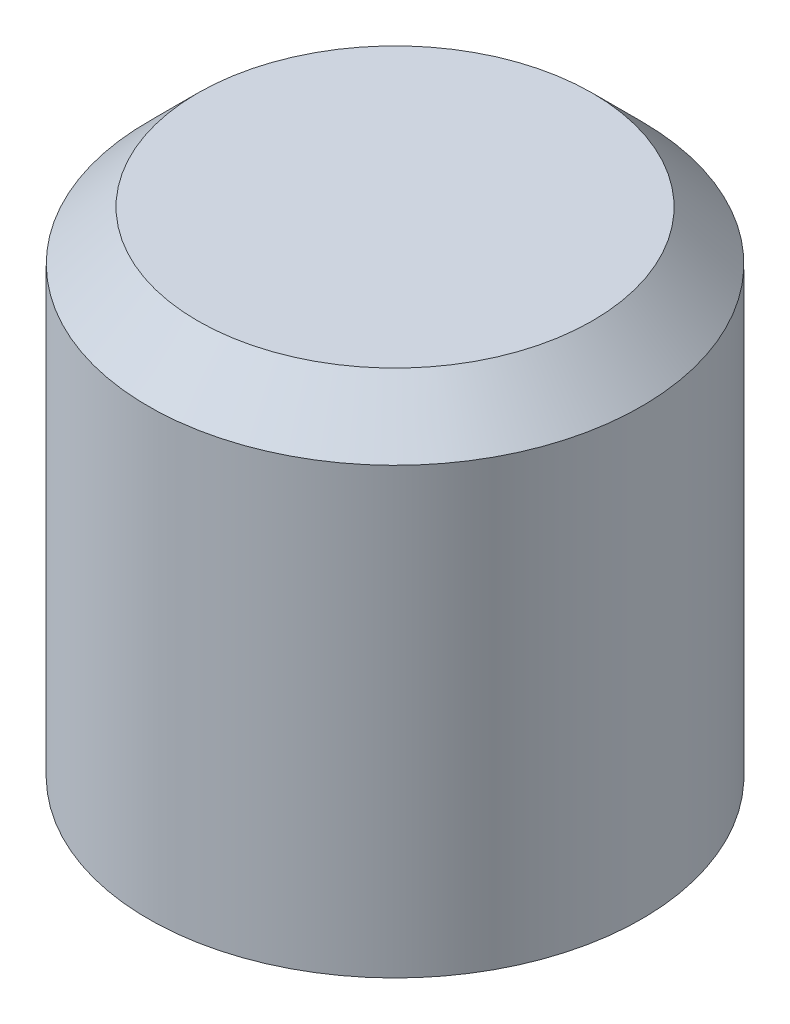
from build123d import *


with BuildPart() as part:
    # sketch:profile → feature:turned (revolve)
    with BuildSketch(Plane.XY, mode=Mode.PRIVATE) as feature_turned_sk:
        Polygon((0, 0), (10, 0), (10, 18), (8, 20), (0, 20), align=None)
    revolve(feature_turned_sk.sketch.rotate(Axis((0, -10, 0), (0, 1, 0)), 90), axis=Axis((0, -10, 0), (0, 1, 0)))


solid = part.part
